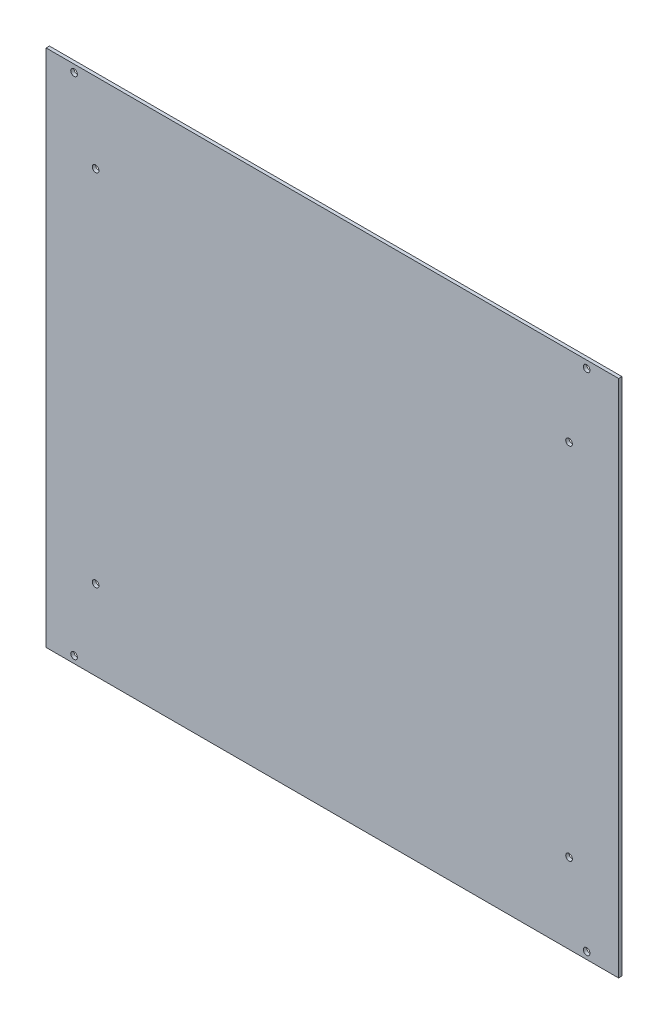
from build123d import *

# Parameters (mm, degrees)
SKETCH1_W           = 546.1
SKETCH1_H           = 495.3
BOSS_EXTRUDE1_DEPTH = 3.175
SKETCH3_R           = 3.175
CUT_EXTRUDE2_DEPTH  = 3.175
SKETCH4_R           = 3.175
CUT_EXTRUDE3_DEPTH  = 16.764


with BuildPart() as part:
    # Sketch1 → Boss-Extrude1 (new body)
    with BuildSketch(Plane.XY):
        Rectangle(SKETCH1_W, SKETCH1_H)
    extrude(amount=BOSS_EXTRUDE1_DEPTH)

    # Sketch3 → Cut-Extrude2 (cut)
    with BuildSketch(Plane.XY.offset(3.175)):
        with Locations((-225.806, 171.45)):
            Circle(SKETCH3_R)
        with Locations(Location((225.806, 171.45, 0), (0, 0, 180))):
            Circle(SKETCH3_R)
        with Locations((225.806, -171.45)):
            Circle(SKETCH3_R)
        with Locations(Location((-225.806, -171.45, 0), (0, 0, 180))):
            Circle(SKETCH3_R)
    extrude(amount=-CUT_EXTRUDE2_DEPTH, mode=Mode.SUBTRACT)

    # Sketch4 → Cut-Extrude3 (cut)
    with BuildSketch(Plane.XY.offset(3.175)):
        with Locations((-246.367218899, 240.651834305)):
            Circle(SKETCH4_R)
        with Locations((-246.367218899, -240.982965695)):
            Circle(SKETCH4_R)
        with Locations((242.582781101, -240.982965695)):
            Circle(SKETCH4_R)
        with Locations((242.582781101, 240.651834305)):
            Circle(SKETCH4_R)
    extrude(amount=-CUT_EXTRUDE3_DEPTH, mode=Mode.SUBTRACT)


solid = part.part
